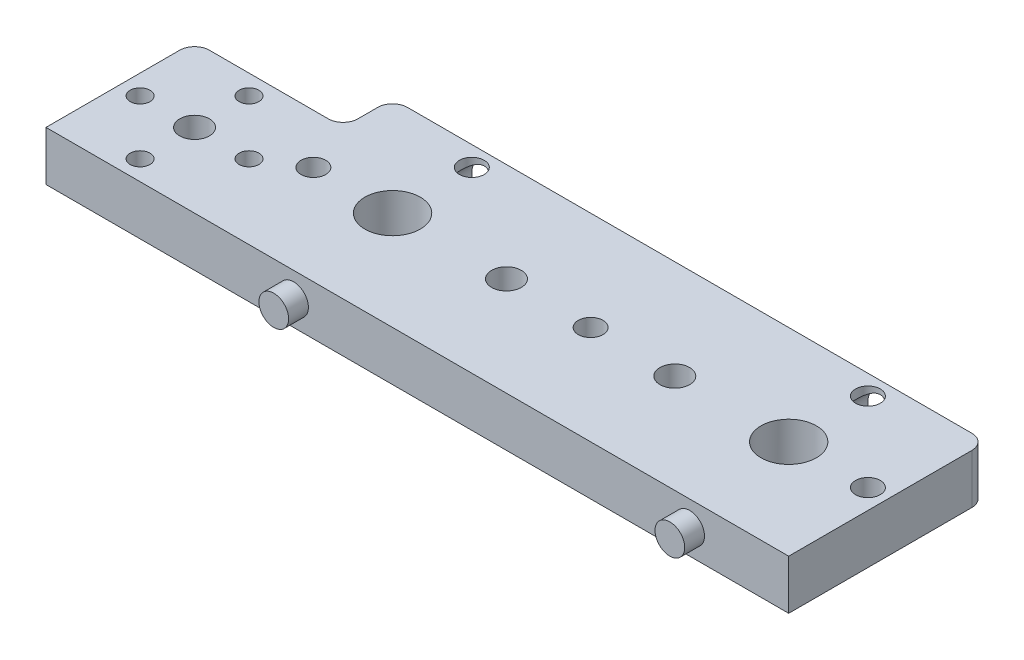
from build123d import *

# Parameters (mm, degrees)
SKETCH_1_W          = 15
SKETCH_1_H          = 15
EXTRUDE_1_DEPTH     = 5
SKETCH_2_R          = 1.5
SKETCH_2_R_2        = 1.25
SKETCH_2_R_3        = 2.8
SKETCH_2_R_4        = 1
CUT_EXTRUDE_1_DEPTH = 5
FILLET_1_R          = 1.5
SKETCH_4_R          = 1.5
EXTRUDE_2_DEPTH     = 2
SKETCH_5_R          = 2
CUT_EXTRUDE_2_DEPTH = 5


with BuildPart() as part:
    # 草图1 → 凸台-拉伸1 (new body)
    with BuildSketch(Plane(origin=(0, 0, 0), x_dir=(1, 0, 0), z_dir=(0, 1, 0))):
        Polygon((30, 10), (-30, 10), (-30, 5), (-30, -10), (30, -10), align=None)
        with Locations((-37.5, -2.5)):
            Rectangle(SKETCH_1_W, SKETCH_1_H)
    extrude(amount=EXTRUDE_1_DEPTH)

    # 草图2 → 切除-拉伸1 (cut)
    with BuildSketch(Plane(origin=(0, 5, 0), x_dir=(1, 0, 0), z_dir=(0, 1, 0))):
        with Locations(Location((8.5, 0, 0), (0, 0, 270))):
            Circle(SKETCH_2_R)
        with Locations(Location((-8.5, 0, 0), (0, 0, 90))):
            Circle(SKETCH_2_R)
        with Locations(Location((0, 0, 0), (0, 0, 270))):
            Circle(SKETCH_2_R_2)
        with Locations(Location((20, 0, 0), (0, 0, 270))):
            Circle(SKETCH_2_R_3)
        with Locations(Location((-20, 0, 0), (0, 0, 90))):
            Circle(SKETCH_2_R_3)
        with Locations(Location((20, 8, 0), (0, 0, 270))):
            Circle(SKETCH_2_R_2)
        with Locations(Location((28, 0, 0), (0, 0, 270))):
            Circle(SKETCH_2_R_2)
        with Locations(Location((-28, 0, 0), (0, 0, 90))):
            Circle(SKETCH_2_R_2)
        with Locations(Location((-20, 8, 0), (0, 0, 90))):
            Circle(SKETCH_2_R_2)
        with Locations(Location((-37.5, -2.5, 0), (0, 0, 270))):
            Circle(SKETCH_2_R)
        with Locations(Location((-32, -2.5, 0), (0, 0, 270))):
            Circle(SKETCH_2_R_4)
        with Locations(Location((-37.5, -8, 0), (0, 0, 270))):
            Circle(SKETCH_2_R_4)
        with Locations(Location((-43, -2.5, 0), (0, 0, 270))):
            Circle(SKETCH_2_R_4)
        with Locations(Location((-37.5, 3, 0), (0, 0, 270))):
            Circle(SKETCH_2_R_4)
    extrude(amount=-CUT_EXTRUDE_1_DEPTH, mode=Mode.SUBTRACT)

    # 圆角1
    fillet_1_edges = [part.edges().sort_by_distance(p)[0] for p in [
        (-30, 2.5, -5),
        (-45, 2.5, -5),
        (-30, 2.5, -10),
        (30, 2.5, -10),
    ]]
    fillet(fillet_1_edges, radius=FILLET_1_R)

    # 草图4 → 凸台-拉伸2 (add)
    with BuildSketch(Plane.XY.offset(10)):
        with Locations(Location((20, 2.5, 0), (0, 0, 180))):
            Circle(SKETCH_4_R)
        with Locations(Location((-20, 2.5, 0), (0, 0, 180))):
            Circle(SKETCH_4_R)
    extrude(amount=EXTRUDE_2_DEPTH)

    # 草图5 → 切除-拉伸2 (cut)
    with BuildSketch(Plane(origin=(0, 0, -10), x_dir=(-1, 0, 0), z_dir=(0, 0, -1))):
        with Locations((-20, 2.5)):
            Circle(SKETCH_5_R)
        with Locations(Location((20, 2.5, 0), (0, 0, 180))):
            Circle(SKETCH_5_R)
    extrude(amount=-CUT_EXTRUDE_2_DEPTH, mode=Mode.SUBTRACT)


solid = part.part
